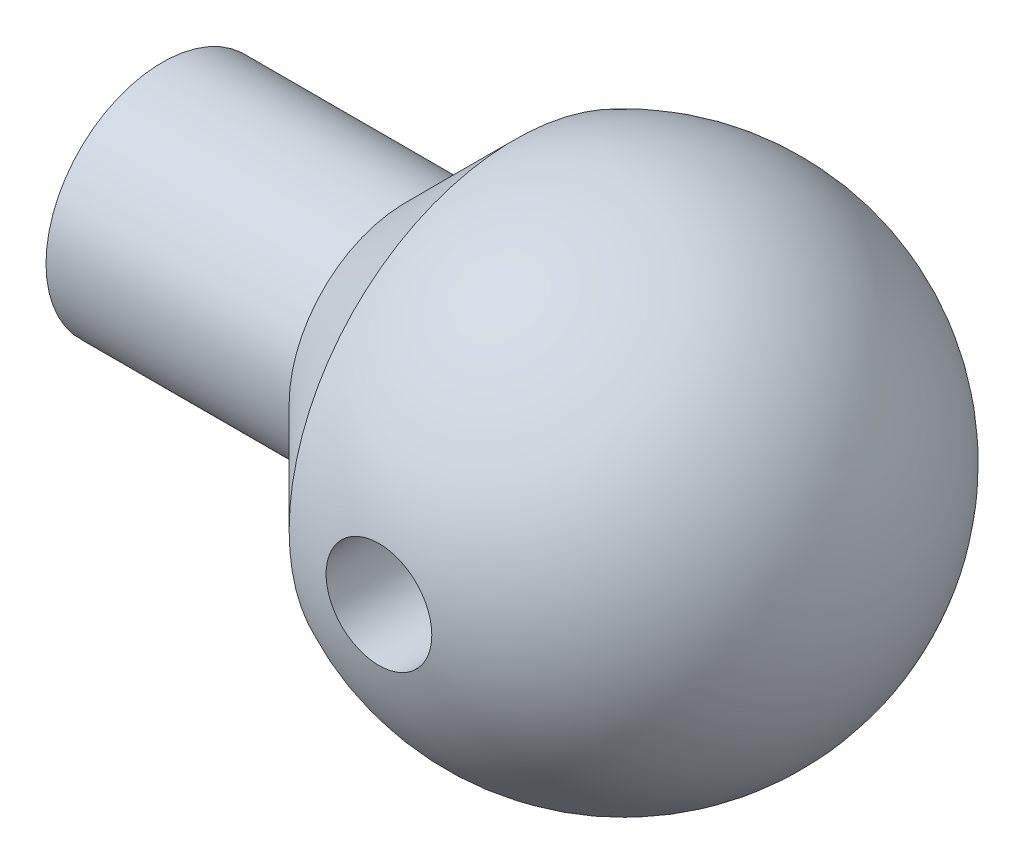
from build123d import *

# Parameters (mm, degrees)
CUT_EXTRUDE_1_DEPTH      = 25.366329598
CUT_EXTRUDE_1_DEPTH_BACK = 25.366329598
SKETCH_8_R               = 1.5


with BuildPart() as part:
    # 草图1 → 旋转1 (revolve)
    with BuildSketch(Plane.XY, mode=Mode.PRIVATE) as revolve_1_sk:
        with BuildLine():
            Line((0, 0), (1.982840043, -3.3))
            Line((1.982840043, -3.3), (8.882840043, -3.3))
            Line((8.882840043, -3.3), (11.982840043, -6.4))
            ThreePointArc((11.982840043, -6.4), (18.859419057, -6.025566442), (22.194098722, 0))
            Line((22.194098722, 0), (0, 0))
        make_face()
    revolve(revolve_1_sk.sketch.rotate(Axis((0, 0, 0), (1, 0, 0)), 270), axis=Axis((0, 0, 0), (1, 0, 0)))

    # 草图8 → 切除-拉伸1 (cut, two sides: drawn at the far end of the back side and taken through both)
    with BuildSketch(Plane.XY.offset(-CUT_EXTRUDE_1_DEPTH_BACK)):
        with Locations((15.082840043, 0)):
            Circle(SKETCH_8_R)
    extrude(amount=CUT_EXTRUDE_1_DEPTH + CUT_EXTRUDE_1_DEPTH_BACK, mode=Mode.SUBTRACT)


solid = part.part
